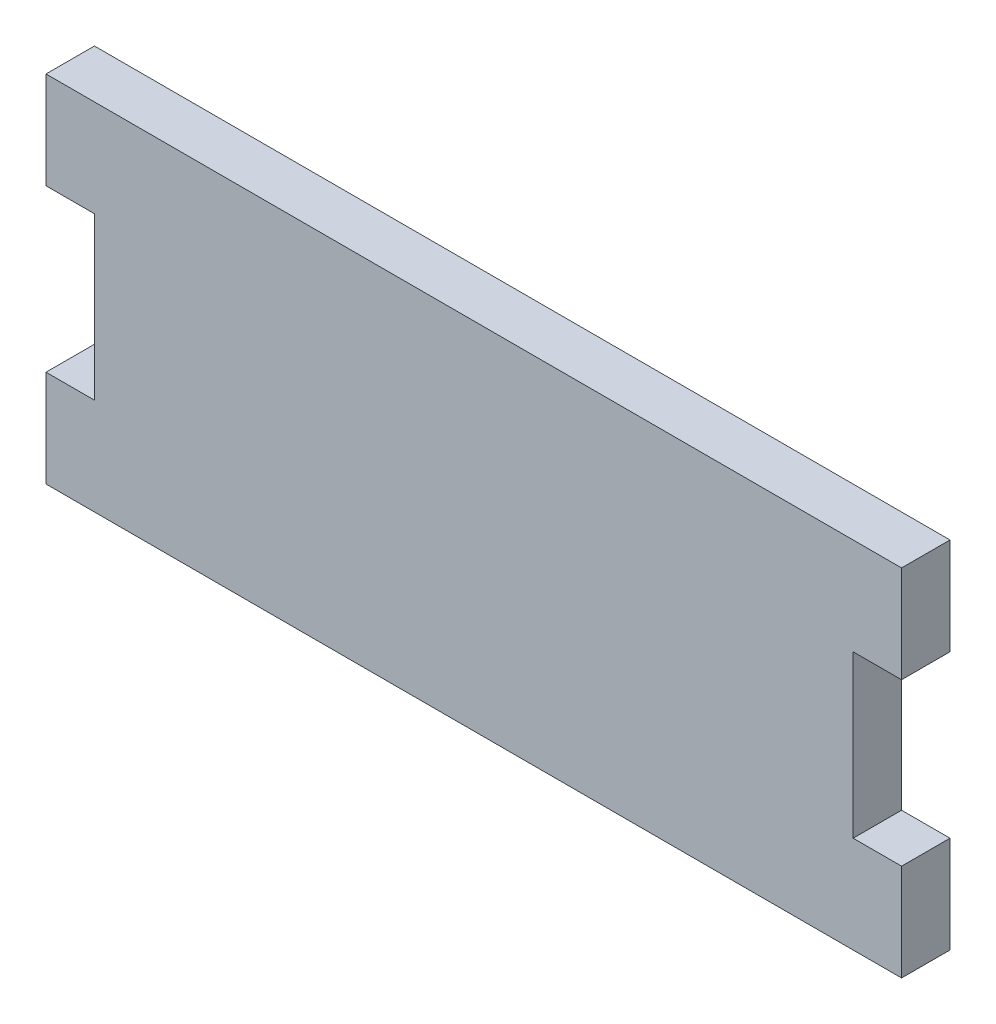
from build123d import *

# Parameters (mm, degrees)
BOSS_EXTRUDE1_DEPTH = 1.5
SKETCH2_W           = 3
SKETCH2_H           = 10
CUT_EXTRUDE1_DEPTH  = 56.865910894
SKETCH3_W           = 55
SKETCH3_H           = 25
CUT_EXTRUDE2_DEPTH  = 56.865910894
SKETCH6_W           = 15
SKETCH6_H           = 3
CUT_EXTRUDE5_DEPTH  = 56.865910894


with BuildPart() as part:
    # Sketch1 → Boss-Extrude1 (new, symmetric)
    with BuildSketch(Plane.XY):
        Polygon((-20, -11), (20, -11), (20, -14), (35, -14), (35, -11), (54, -11), (54, 11), (-54, 11), (-54, -11), (-35, -11), (-35, -14), (-20, -14), align=None)
    extrude(amount=BOSS_EXTRUDE1_DEPTH, both=True)

    # Sketch2 → Cut-Extrude1 (cut, through all)
    with BuildSketch(Plane.XY.offset(1.5)):
        with Locations((2.5, 0)):
            Rectangle(SKETCH2_W, SKETCH2_H)
        with Locations((52.5, 0)):
            Rectangle(SKETCH2_W, SKETCH2_H)
    extrude(amount=-CUT_EXTRUDE1_DEPTH, mode=Mode.SUBTRACT)

    # Sketch3 → Cut-Extrude2 (cut, through all)
    with BuildSketch(Plane.XY.offset(1.5)):
        with Locations((-26.5, -1.5)):
            Rectangle(SKETCH3_W, SKETCH3_H)
    extrude(amount=-CUT_EXTRUDE2_DEPTH, mode=Mode.SUBTRACT)

    # Sketch6 → Cut-Extrude5 (cut, through all)
    with BuildSketch(Plane.XY.offset(1.5)):
        with Locations((27.5, -12.5)):
            Rectangle(SKETCH6_W, SKETCH6_H)
    extrude(amount=-CUT_EXTRUDE5_DEPTH, mode=Mode.SUBTRACT)


solid = part.part
